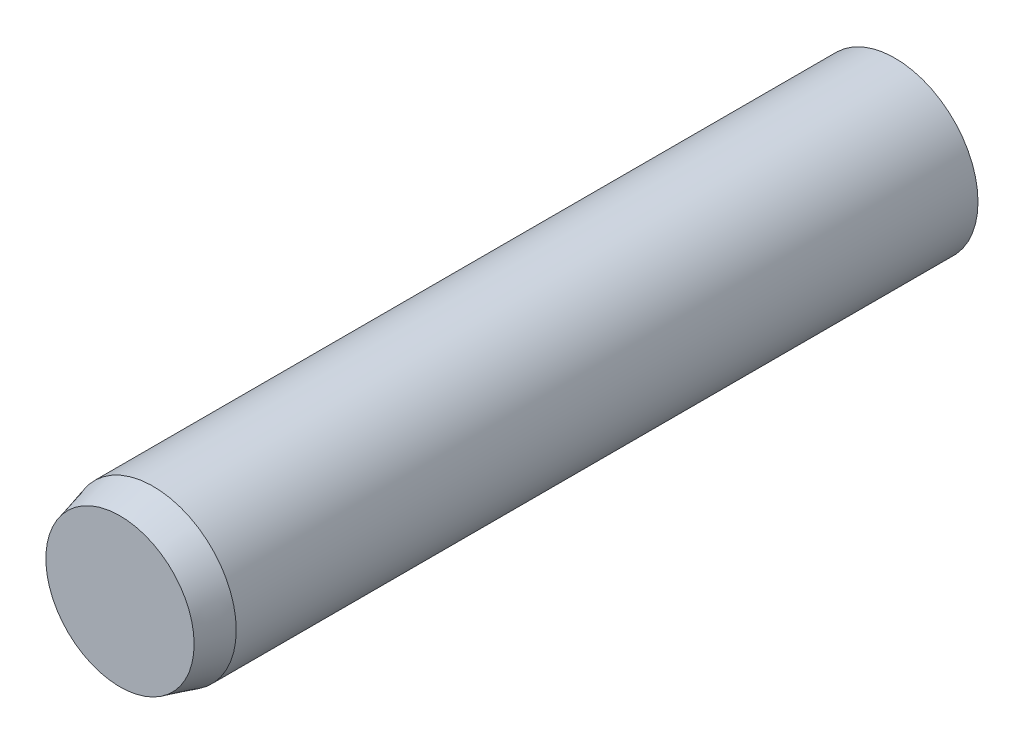
from build123d import *

# Parameters (mm, degrees)
SKIZZE1_R                       = 1.5
AUFSATZ_LINEAR_AUSTRAGEN1_DEPTH = 14
FASE1_SIZE                      = 0.6
FASE1_SIZE2                     = 0.160769515


with BuildPart() as part:
    # Skizze1 → Aufsatz-Linear austragen1 (new body)
    with BuildSketch(Plane.XY):
        Circle(SKIZZE1_R)
    extrude(amount=AUFSATZ_LINEAR_AUSTRAGEN1_DEPTH)

    # Fase1
    fase1_edges = [part.edges().sort_by_distance(p)[0] for p in [
        (-1.5, 0, 14),
    ]]
    fase1_side = [part.faces().sort_by_distance(p)[0] for p in [
        (-1.5, 0, 7),
    ]]
    chamfer(fase1_edges, length=FASE1_SIZE, length2=FASE1_SIZE2, reference=fase1_side[0])


solid = part.part
